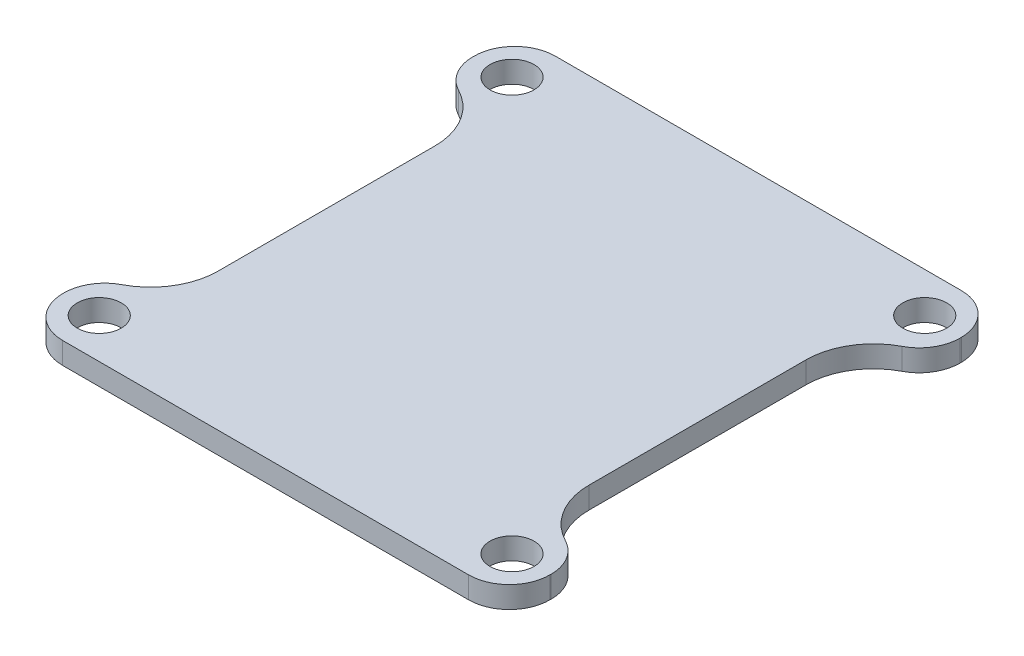
from build123d import *

# Parameters (mm, degrees)
SKETCH1_R           = 1.625
BOSS_EXTRUDE1_DEPTH = 1.6
FILLET1_R           = 3
FILLET2_R           = 5


with BuildPart() as part:
    # Sketch1 → Boss-Extrude1 (new body)
    with BuildSketch(Plane(origin=(0, 0, 0), x_dir=(1, 0, 0), z_dir=(0, 1, 0))):
        Polygon((-18, 18.2), (-18, 12.1), (-13.7, 12.1), (-13.7, -12.1), (-18, -12.1), (-18, -18.2), (18, -18.2), (18, -12.1), (13.7, -12.1), (13.7, 12.1), (18, 12.1), (18, 18.2), align=None)
        with Locations(Location((15.25, -15.25, 0), (0, 0, 270))):
            Circle(SKETCH1_R, mode=Mode.SUBTRACT)
        with Locations(Location((15.25, 15.25, 0), (0, 0, 270))):
            Circle(SKETCH1_R, mode=Mode.SUBTRACT)
        with Locations(Location((-15.25, 15.25, 0), (0, 0, 270))):
            Circle(SKETCH1_R, mode=Mode.SUBTRACT)
        with Locations(Location((-15.25, -15.25, 0), (0, 0, 270))):
            Circle(SKETCH1_R, mode=Mode.SUBTRACT)
    extrude(amount=BOSS_EXTRUDE1_DEPTH)

    # Fillet1
    fillet1_edges = [part.edges().sort_by_distance(p)[0] for p in [
        (-18, 0.8, 18.2),
        (-18, 0.8, 12.1),
        (-18, 0.8, -12.1),
        (-18, 0.8, -18.2),
        (18, 0.8, -18.2),
        (18, 0.8, -12.1),
        (18, 0.8, 12.1),
        (18, 0.8, 18.2),
    ]]
    fillet(fillet1_edges, radius=FILLET1_R)

    # Fillet2
    fillet2_edges = [part.edges().sort_by_distance(p)[0] for p in [
        (13.7, 0.8, -12.1),
        (13.7, 0.8, 12.1),
        (-13.7, 0.8, 12.1),
        (-13.7, 0.8, -12.1),
    ]]
    fillet(fillet2_edges, radius=FILLET2_R)


solid = part.part
